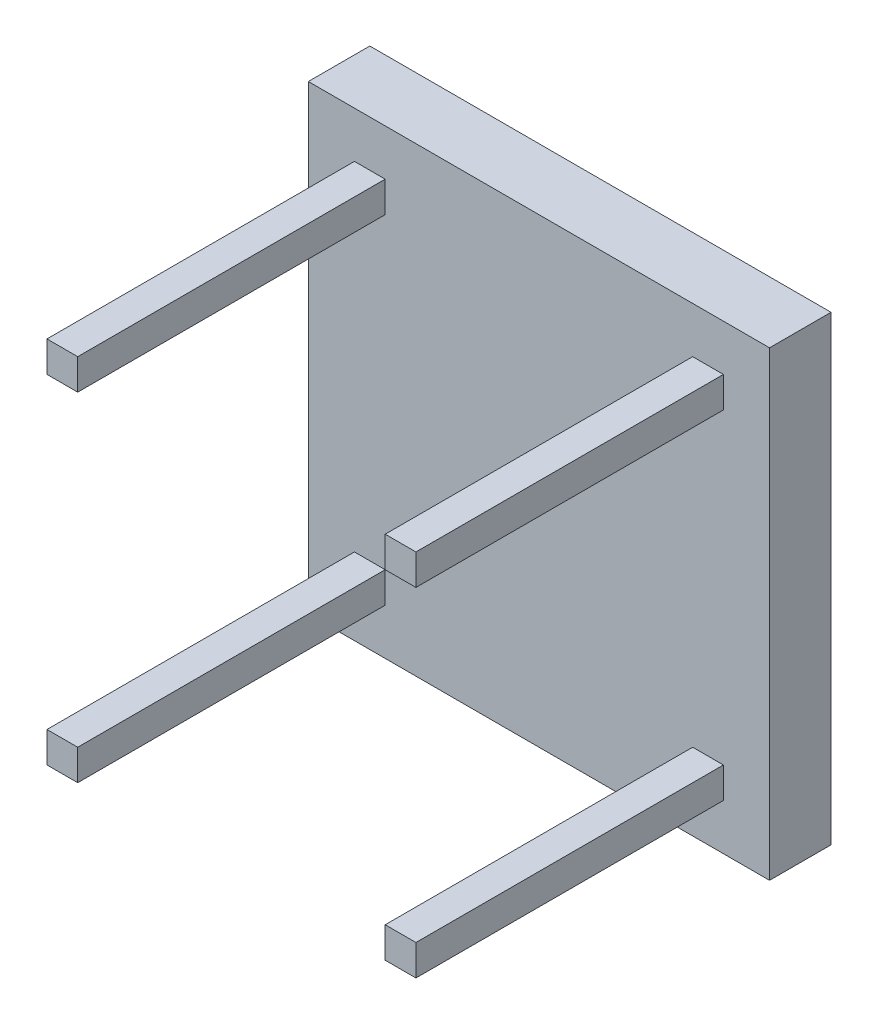
from build123d import *

# Parameters (mm, degrees)
SKETCH1_W           = 300
SKETCH1_H           = 300
BOSS_EXTRUDE1_DEPTH = 40
SKETCH2_W           = 20
SKETCH2_H           = 20
BOSS_EXTRUDE2_DEPTH = 200


with BuildPart() as part:
    # Sketch1 → Boss-Extrude1 (new body)
    with BuildSketch(Plane.XY):
        Rectangle(SKETCH1_W, SKETCH1_H)
    extrude(amount=BOSS_EXTRUDE1_DEPTH)

    # Sketch2 → Boss-Extrude2 (add)
    with BuildSketch(Plane.XY.offset(40)):
        with Locations((110, 110)):
            Rectangle(SKETCH2_W, SKETCH2_H)
        with Locations((-110, 110)):
            Rectangle(SKETCH2_W, SKETCH2_H)
        with Locations((-110, -110)):
            Rectangle(SKETCH2_W, SKETCH2_H)
        with Locations((110, -110)):
            Rectangle(SKETCH2_W, SKETCH2_H)
    extrude(amount=BOSS_EXTRUDE2_DEPTH)


solid = part.part
